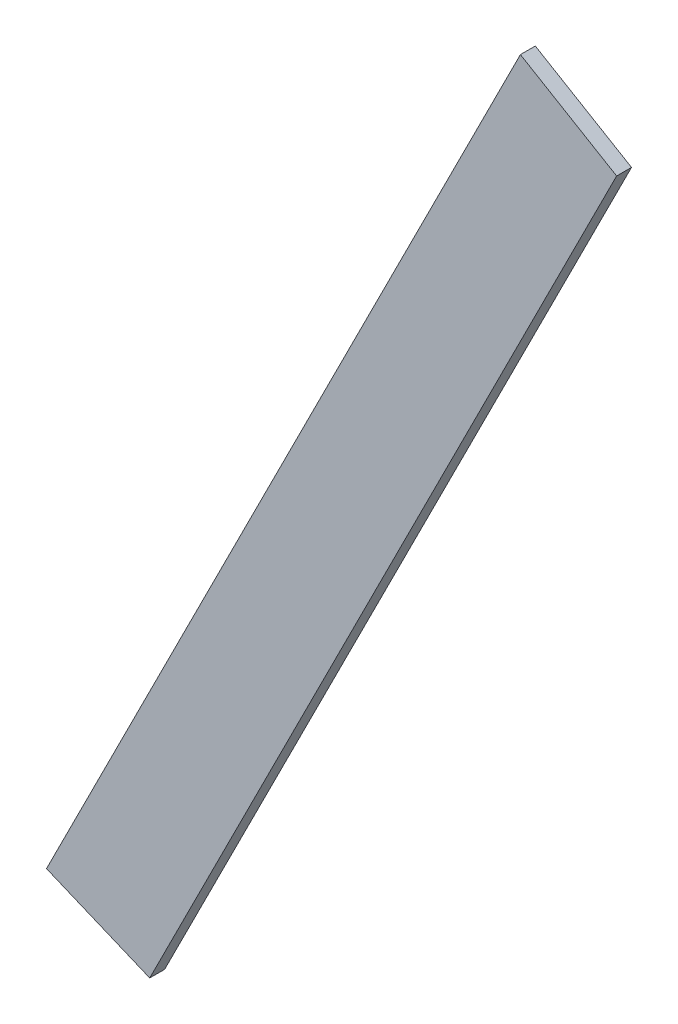
from build123d import *

# Parameters (mm, degrees)
BOSS_EXTRUDE1_DEPTH = 2


with BuildPart() as part:
    # Sketch1 → Boss-Extrude1 (new body)
    with BuildSketch(Plane.XY):
        Polygon((31.417587204, -12.775658975), (17.540700438, -6.982573646), (81.252089689, 119.646766322), (94.186115232, 111.979700601), align=None)
    extrude(amount=BOSS_EXTRUDE1_DEPTH)


solid = part.part
